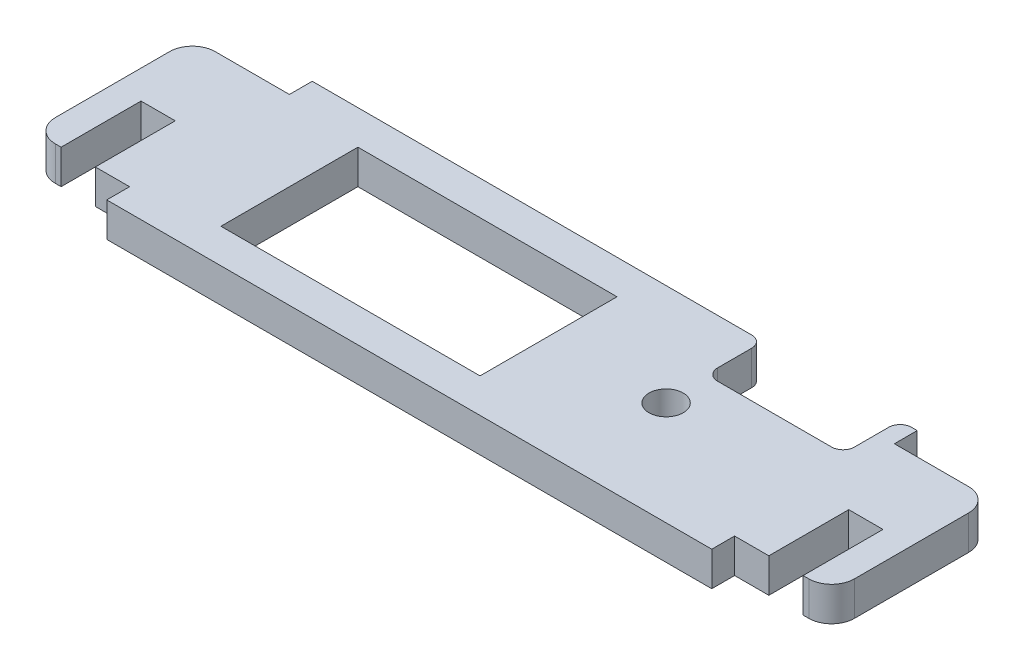
from build123d import *

# Parameters (mm, degrees)
BOSS_EXTRUDE1_DEPTH = 3
SKETCH2_W           = 22.7
SKETCH2_H           = 12
CUT_EXTRUDE1_DEPTH  = 3
SKETCH3_W           = 3
SKETCH3_H           = 7
CUT_EXTRUDE2_DEPTH  = 3
SKETCH4_R           = 1.5
CUT_EXTRUDE3_DEPTH  = 3


with BuildPart() as part:
    # Sketch1 → Boss-Extrude1 (new body)
    with BuildSketch(Plane(origin=(0, 0, 0), x_dir=(1, 0, 0), z_dir=(0, 1, 0))):
        with BuildLine():
            Line((-9.820632273, 11.009972833), (-9.820632273, 1.009972833))
            ThreePointArc((-9.820632273, 1.009972833), (-10.40641871, -0.404240729), (-11.820632273, -0.990027167))
            Line((-11.820632273, -0.990027167), (-18.320632273, -0.990027167))
            Line((-18.320632273, -0.990027167), (-18.320632273, -2.990027167))
            Line((-18.320632273, -2.990027167), (-71.320632273, -2.990027167))
            Line((-71.320632273, -2.990027167), (-71.320632273, -0.990027167))
            Line((-71.320632273, -0.990027167), (-77.820632273, -0.990027167))
            ThreePointArc((-77.820632273, -0.990027167), (-79.234845835, -0.404240729), (-79.820632273, 1.009972833))
            Line((-79.820632273, 1.009972833), (-79.820632273, 11.009972833))
            ThreePointArc((-79.820632273, 11.009972833), (-79.234845835, 12.424186396), (-77.820632273, 13.009972833))
            Line((-77.820632273, 13.009972833), (-71.320632273, 13.009972833))
            Line((-71.320632273, 13.009972833), (-71.320632273, 15.009972833))
            Line((-71.320632273, 15.009972833), (-32.820632273, 15.009972833))
            ThreePointArc((-32.820632273, 15.009972833), (-32.113525492, 14.717079615), (-31.820632273, 14.009972833))
            Line((-31.820632273, 14.009972833), (-31.820632273, 11.009972833))
            ThreePointArc((-31.820632273, 11.009972833), (-31.527739054, 10.302866052), (-30.820632273, 10.009972833))
            Line((-30.820632273, 10.009972833), (-20.820632273, 10.009972833))
            ThreePointArc((-20.820632273, 10.009972833), (-20.113525492, 10.302866052), (-19.820632273, 11.009972833))
            Line((-19.820632273, 11.009972833), (-19.820632273, 14.009972833))
            ThreePointArc((-19.820632273, 14.009972833), (-19.527739054, 14.717079615), (-18.820632273, 15.009972833))
            Line((-18.820632273, 15.009972833), (-18.320632273, 15.009972833))
            Line((-18.320632273, 15.009972833), (-18.320632273, 13.009972833))
            Line((-18.320632273, 13.009972833), (-11.820632273, 13.009972833))
            ThreePointArc((-11.820632273, 13.009972833), (-10.40641871, 12.424186396), (-9.820632273, 11.009972833))
        make_face()
    extrude(amount=BOSS_EXTRUDE1_DEPTH)

    # Sketch2 → Cut-Extrude1 (cut)
    with BuildSketch(Plane(origin=(0, 3, 0), x_dir=(1, 0, 0), z_dir=(0, 1, 0))):
        with Locations((-52.970632273, 6.009972833)):
            Rectangle(SKETCH2_W, SKETCH2_H)
    extrude(amount=-CUT_EXTRUDE1_DEPTH, mode=Mode.SUBTRACT)

    # Sketch3 → Cut-Extrude2 (cut)
    with BuildSketch(Plane(origin=(0, 3, 0), x_dir=(1, 0, 0), z_dir=(0, 1, 0))):
        with Locations((-13.820632273, 2.509972833)):
            Rectangle(SKETCH3_W, SKETCH3_H)
        with Locations((-75.820632273, 2.509972833)):
            Rectangle(SKETCH3_W, SKETCH3_H)
    extrude(amount=-CUT_EXTRUDE2_DEPTH, mode=Mode.SUBTRACT)

    # Sketch4 → Cut-Extrude3 (cut)
    with BuildSketch(Plane(origin=(0, 3, 0), x_dir=(1, 0, 0), z_dir=(0, 1, 0))):
        with Locations(Location((-31.420632273, 6.109972833, 0), (0, 0, 270))):
            Circle(SKETCH4_R)
    extrude(amount=-CUT_EXTRUDE3_DEPTH, mode=Mode.SUBTRACT)


solid = part.part
